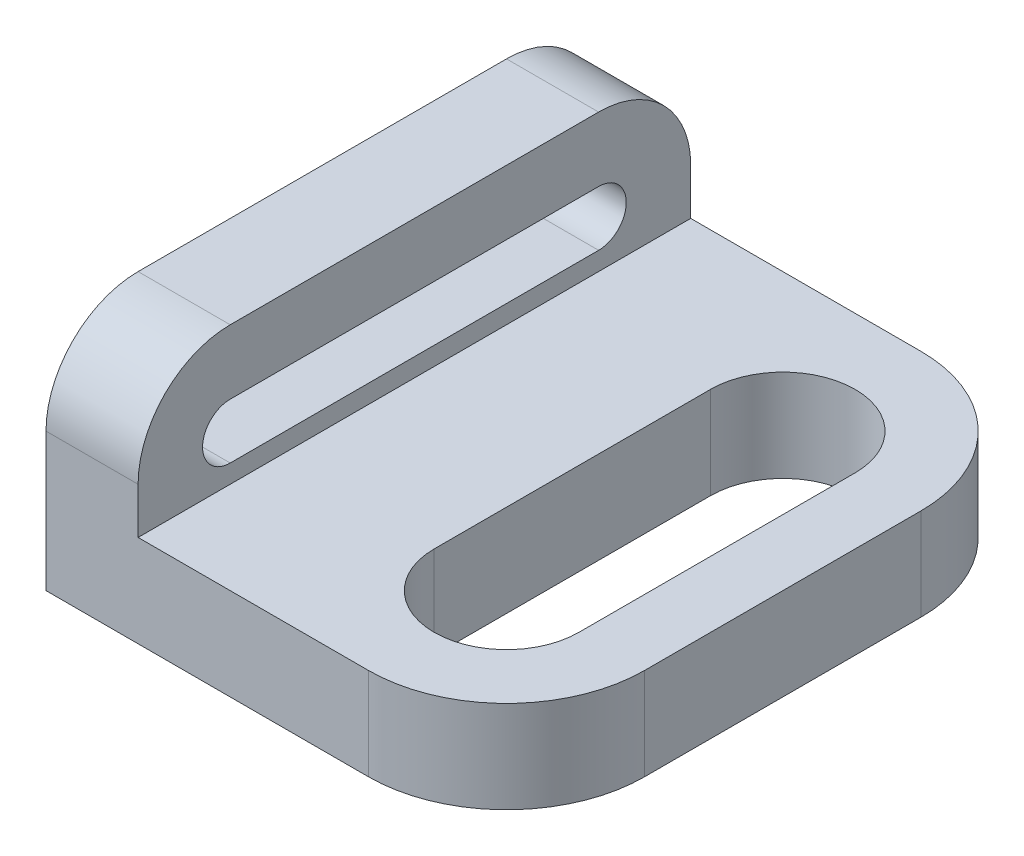
from build123d import *

# Parameters (mm, degrees)
IZIM2_W                     = 80
IZIM2_H                     = 120
IZIM2_W_2                   = 20
Y_KSEKLIK_EKSTR_ZYON3_DEPTH = 20
RADYUS1_R                   = 30
IZIM3_W                     = 20
IZIM3_H                     = 120
EKSTR_ZYON_NCE1_DEPTH       = 50
RADYUS2_R                   = 20
KES_EKSTR_ZYON3_DEPTH       = 20


with BuildPart() as part:
    # Çizim2 → Yükseklik-Ekstrüzyon3 (new body)
    # profile 1 of 2: a face of its own
    with BuildSketch(Plane(origin=(0, 0, 0), x_dir=(1, 0, 0), z_dir=(0, 1, 0))):
        with Locations((-4.018691589, -18.785046729)):
            Rectangle(IZIM2_W, IZIM2_H)
        with BuildLine():
            ThreePointArc((-9.719626168, 11.214953271), (5.981308411, 26.91588785), (21.682242991, 11.214953271))
            Line((21.682242991, 11.214953271), (21.682242991, -48.785046729))
            ThreePointArc((21.682242991, -48.785046729), (5.981308411, -64.485981308), (-9.719626168, -48.785046729))
            Line((-9.719626168, -48.785046729), (-9.719626168, 11.214953271))
        make_face(mode=Mode.SUBTRACT)
    # profile 2 of 2: a face of its own
    with BuildSketch(Plane(origin=(0, 0, 0), x_dir=(1, 0, 0), z_dir=(0, 1, 0))):
        with Locations((-54.018691589, -18.785046729)):
            Rectangle(IZIM2_W_2, IZIM2_H)
    extrude(amount=Y_KSEKLIK_EKSTR_ZYON3_DEPTH)

    # Radyus1
    radyus1_edges = [part.edges().sort_by_distance(p)[0] for p in [
        (35.981308411, 10, -41.214953271),
        (35.981308411, 10, 78.785046729),
    ]]
    fillet(radyus1_edges, radius=RADYUS1_R)

    # Çizim3 → Ekstrüzyon-İnce1 (add)
    with BuildSketch(Plane(origin=(0, 0, 0), x_dir=(1, 0, 0), z_dir=(0, 1, 0))):
        with Locations((-54.018691589, -18.785046729)):
            Rectangle(IZIM3_W, IZIM3_H)
    extrude(amount=EKSTR_ZYON_NCE1_DEPTH)

    # Radyus2
    radyus2_edges = [part.edges().sort_by_distance(p)[0] for p in [
        (-54.018691589, 50, 78.785046729),
        (-54.018691589, 50, -41.214953271),
    ]]
    fillet(radyus2_edges, radius=RADYUS2_R)

    # Çizim6 → Kes-Ekstrüzyon3 (cut)
    with BuildSketch(Plane(origin=(-44.018691589, 0, 0), x_dir=(0, 0, -1), z_dir=(1, 0, 0))):
        with BuildLine():
            Line((-58.785046729, 36), (21.214953271, 36))
            ThreePointArc((21.214953271, 36), (27.214953271, 30), (21.214953271, 24))
            Line((21.214953271, 24), (-58.785046729, 24))
            ThreePointArc((-58.785046729, 24), (-64.785046729, 30), (-58.785046729, 36))
        make_face()
    extrude(amount=-KES_EKSTR_ZYON3_DEPTH, mode=Mode.SUBTRACT)


solid = part.part
